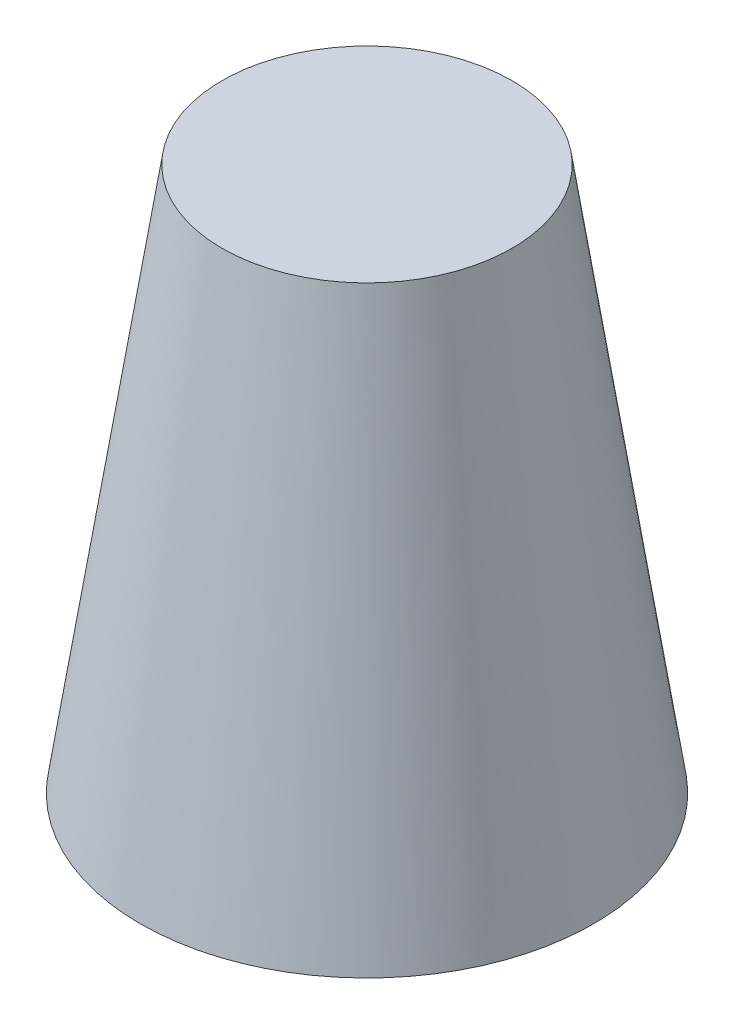
from build123d import *


with BuildPart() as part:
    # 草图2 → 旋转2 (revolve)
    with BuildSketch(Plane(origin=(0, 0, 0), x_dir=(0, 0, -1), z_dir=(1, 0, 0)), mode=Mode.PRIVATE) as revolve_2_sk:
        Polygon((0, 60), (0, 57), (3, 57), (13.416437738, 57), (21.516437738, 3), (21.966437738, 0), (25, 0), (16, 60), align=None)
        Polygon((5, 3), (5, 0), (21.966437738, 0), (21.516437738, 3), align=None)
    revolve(revolve_2_sk.sketch.rotate(Axis((0, 60, 0), (0, -1, 0)), 180), axis=Axis((0, 60, 0), (0, -1, 0)))


solid = part.part
